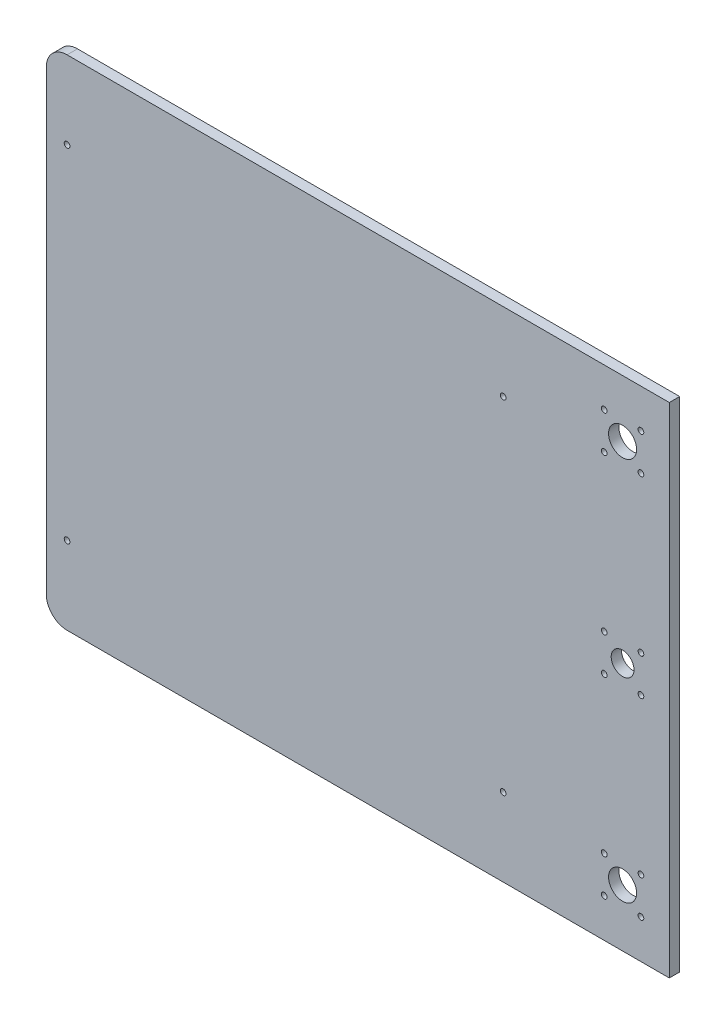
from build123d import *

# Parameters (mm, degrees)
SKETCH_1_W      = 600
SKETCH_1_H      = 480
SKETCH_1_R      = 2.75
SKETCH_1_R_2    = 13.5
SKETCH_1_R_3    = 11
EXTRUDE_1_DEPTH = 10
FILLET_1_R      = 20


with BuildPart() as part:
    # Эскиз1 → Бобышка-Вытянуть1 (new body)
    with BuildSketch(Plane.XY):
        with Locations((-255, 0)):
            Rectangle(SKETCH_1_W, SKETCH_1_H)
        with Locations((-535, -165)):
            Circle(SKETCH_1_R, mode=Mode.SUBTRACT)
        with Locations((-115, -165)):
            Circle(SKETCH_1_R, mode=Mode.SUBTRACT)
        with Locations((-17.67766953, -202.67766953)):
            Circle(SKETCH_1_R, mode=Mode.SUBTRACT)
        with Locations((0, -185)):
            Circle(SKETCH_1_R_2, mode=Mode.SUBTRACT)
        with Locations((17.67766953, -202.67766953)):
            Circle(SKETCH_1_R, mode=Mode.SUBTRACT)
        with Locations((-17.67766953, -167.32233047)):
            Circle(SKETCH_1_R, mode=Mode.SUBTRACT)
        with Locations((17.67766953, -167.32233047)):
            Circle(SKETCH_1_R, mode=Mode.SUBTRACT)
        with Locations((-17.67766953, -17.67766953)):
            Circle(SKETCH_1_R, mode=Mode.SUBTRACT)
        with Locations((17.67766953, -17.67766953)):
            Circle(SKETCH_1_R, mode=Mode.SUBTRACT)
        with Locations((-535, 165)):
            Circle(SKETCH_1_R, mode=Mode.SUBTRACT)
        Circle(SKETCH_1_R_3, mode=Mode.SUBTRACT)
        with Locations((-17.67766953, 17.67766953)):
            Circle(SKETCH_1_R, mode=Mode.SUBTRACT)
        with Locations((17.67766953, 17.67766953)):
            Circle(SKETCH_1_R, mode=Mode.SUBTRACT)
        with Locations((-115, 165)):
            Circle(SKETCH_1_R, mode=Mode.SUBTRACT)
        with Locations((-17.67766953, 167.32233047)):
            Circle(SKETCH_1_R, mode=Mode.SUBTRACT)
        with Locations((17.67766953, 167.32233047)):
            Circle(SKETCH_1_R, mode=Mode.SUBTRACT)
        with Locations((0, 185)):
            Circle(SKETCH_1_R_2, mode=Mode.SUBTRACT)
        with Locations((-17.67766953, 202.67766953)):
            Circle(SKETCH_1_R, mode=Mode.SUBTRACT)
        with Locations((17.67766953, 202.67766953)):
            Circle(SKETCH_1_R, mode=Mode.SUBTRACT)
    extrude(amount=EXTRUDE_1_DEPTH)

    # Скругление1
    fillet_1_edges = [part.edges().sort_by_distance(p)[0] for p in [
        (-555, 240, 5),
        (-555, -240, 5),
    ]]
    fillet(fillet_1_edges, radius=FILLET_1_R)


solid = part.part
